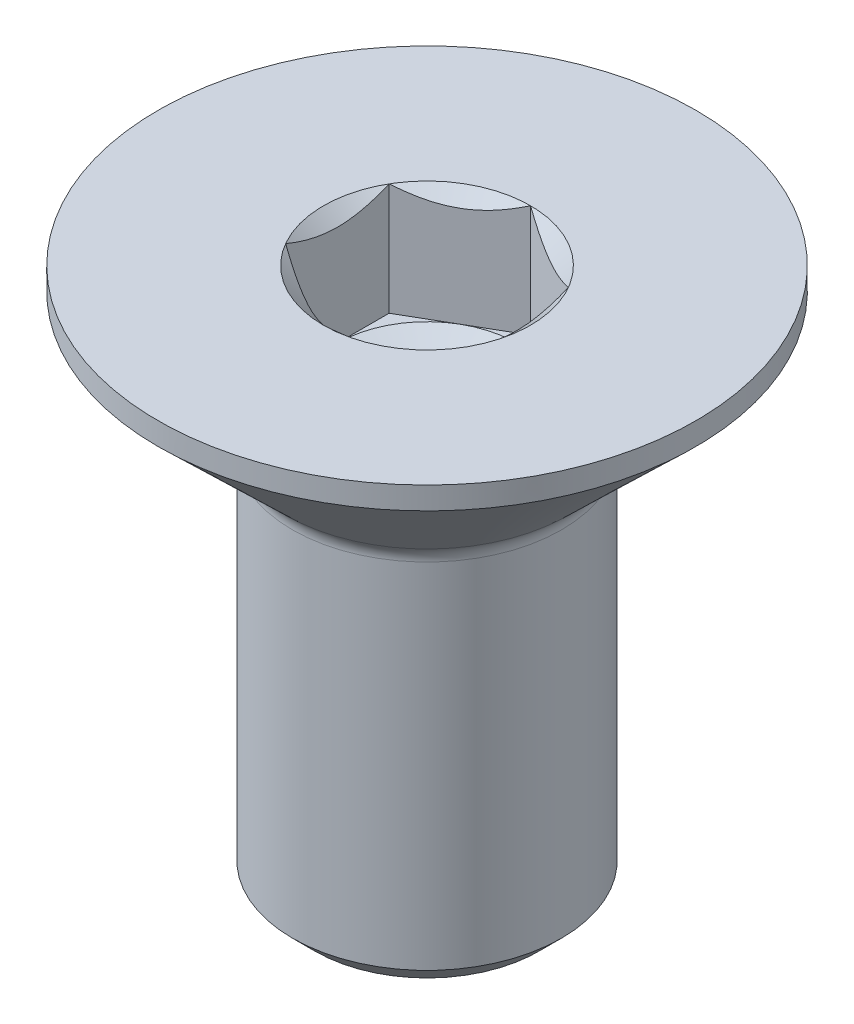
from build123d import *

# Parameters (mm, degrees)
CUT_EXTRUDE1_DEPTH = 2.5
FILLET1_R          = 0.5
CHAMFER1_SIZE      = 0.5


with BuildPart() as part:
    # Sketch1 → Revolve1 (revolve)
    with BuildSketch(Plane.XY, mode=Mode.PRIVATE) as revolve1_sk:
        Polygon((0, 0), (-6, 0), (-6, -0.5), (-3, -3.397066324), (-3, -12), (0, -12), align=None)
    revolve(revolve1_sk.sketch.rotate(Axis((0, 0, 0), (0, 1, 0)), 270), axis=Axis((0, 0, 0), (0, 1, 0)))

    # Sketch2 → Cut-Extrude1 (cut)
    with BuildSketch(Plane(origin=(0, 0, 0), x_dir=(1, 0, 0), z_dir=(0, 1, 0))):
        Polygon((0, 2.309401077), (-2, 1.154700538), (-2, -1.154700538), (0, -2.309401077), (2, -1.154700538), (2, 1.154700538), align=None)
    extrude(amount=-CUT_EXTRUDE1_DEPTH, mode=Mode.SUBTRACT)

    # Sketch3 → Cut-Revolve1 (revolve, cut)
    with BuildSketch(Plane.XY, mode=Mode.PRIVATE) as cut_revolve1_sk:
        Polygon((-2.31, 0), (-2, -0.260120886), (-2, -2.5), (0, -3.227940469), (0, 0), align=None)
    revolve(cut_revolve1_sk.sketch.rotate(Axis((0, -3.227940469, 0), (0, -1, 0)), 270), axis=Axis((0, -3.227940469, 0), (0, -1, 0)), mode=Mode.SUBTRACT)

    # Fillet1
    fillet1_edges = [part.edges().sort_by_distance(p)[0] for p in [
        (0, -3.397066324, 3),
    ]]
    fillet(fillet1_edges, radius=FILLET1_R)

    # Chamfer1
    chamfer1_edges = [part.edges().sort_by_distance(p)[0] for p in [
        (0, -12, 3),
    ]]
    chamfer(chamfer1_edges, length=CHAMFER1_SIZE)


solid = part.part
